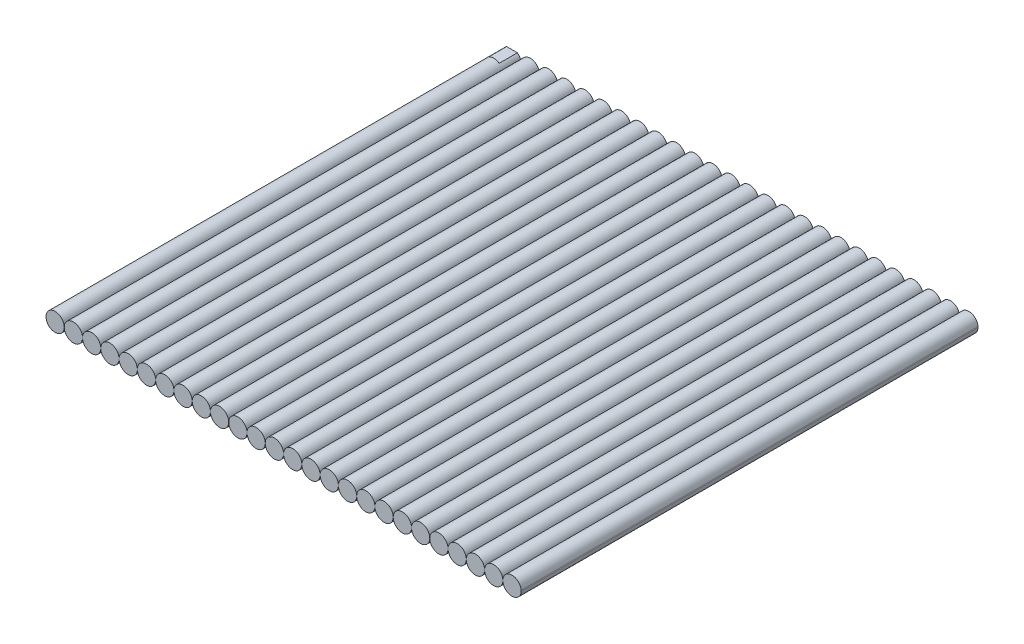
from build123d import *

# Parameters (mm, degrees)
BOSS_EXTRUDE1_DEPTH    = 25
BOSS_EXTRUDE1_2_DEPTH  = 25
BOSS_EXTRUDE1_3_DEPTH  = 25
BOSS_EXTRUDE1_4_DEPTH  = 25
BOSS_EXTRUDE1_5_DEPTH  = 25
BOSS_EXTRUDE1_6_DEPTH  = 25
BOSS_EXTRUDE1_7_DEPTH  = 25
BOSS_EXTRUDE1_8_DEPTH  = 25
BOSS_EXTRUDE1_9_DEPTH  = 25
BOSS_EXTRUDE1_10_DEPTH = 25
BOSS_EXTRUDE1_11_DEPTH = 25
BOSS_EXTRUDE1_12_DEPTH = 25
BOSS_EXTRUDE1_13_DEPTH = 25
BOSS_EXTRUDE1_14_DEPTH = 25
BOSS_EXTRUDE1_15_DEPTH = 25
BOSS_EXTRUDE1_16_DEPTH = 25
BOSS_EXTRUDE1_17_DEPTH = 25
BOSS_EXTRUDE1_18_DEPTH = 25
BOSS_EXTRUDE1_19_DEPTH = 25
BOSS_EXTRUDE1_20_DEPTH = 25
BOSS_EXTRUDE1_21_DEPTH = 25
BOSS_EXTRUDE1_22_DEPTH = 25
BOSS_EXTRUDE1_23_DEPTH = 25
BOSS_EXTRUDE1_24_DEPTH = 25
BOSS_EXTRUDE1_25_DEPTH = 25
BOSS_EXTRUDE1_26_DEPTH = 25
SKETCH2_W              = 0.795505405
SKETCH2_H              = 0.59017602
CUT_EXTRUDE1_DEPTH     = 1


with BuildPart() as part:
    # Sketch1 → Boss-Extrude1 (new body)
    with BuildSketch(Plane.XY):
        with BuildLine():
            ThreePointArc((25.001, 0.5), (25.485188612, 0.000250063), (26, 0.468393039))
            Line((26, 0.468393039), (26, 0.531606961))
            ThreePointArc((26, 0.531606961), (25.485188612, 0.999749937), (25.001, 0.5))
        make_face()
    extrude(amount=BOSS_EXTRUDE1_DEPTH)


with BuildPart() as body_2:
    # Sketch1 → Boss-Extrude1 2 (new body)
    with BuildSketch(Plane.XY):
        with BuildLine():
            ThreePointArc((1, 0.468393039), (1.000749937, 0.484188612), (1.001, 0.5))
            ThreePointArc((1.001, 0.5), (0.001250063, 0.515811388), (1, 0.468393039))
        make_face()
    extrude(amount=BOSS_EXTRUDE1_2_DEPTH)

    # Sketch2 → Cut-Extrude1 (cut)
    with BuildSketch(Plane(origin=(0, 0, 0), x_dir=(-1, 0, 0), z_dir=(0, 0, -1))):
        with Locations((-0.398752703, 1.198419828)):
            Rectangle(SKETCH2_W, SKETCH2_H)
    extrude(amount=-CUT_EXTRUDE1_DEPTH, mode=Mode.SUBTRACT)


with BuildPart() as body_3:
    # Sketch1 → Boss-Extrude1 3 (new body)
    with BuildSketch(Plane.XY):
        with BuildLine():
            ThreePointArc((2, 0.468393039), (2.000749937, 0.484188612), (2.001, 0.5))
            ThreePointArc((2.001, 0.5), (1.501, 1), (1.001, 0.5))
            ThreePointArc((1.001, 0.5), (1.485188612, 0.000250063), (2, 0.468393039))
        make_face()
    extrude(amount=BOSS_EXTRUDE1_3_DEPTH)


with BuildPart() as body_4:
    # Sketch1 → Boss-Extrude1 4 (new body)
    with BuildSketch(Plane.XY):
        with BuildLine():
            ThreePointArc((3, 0.468393039), (3.000749937, 0.484188612), (3.001, 0.5))
            ThreePointArc((3.001, 0.5), (2.501, 1), (2.001, 0.5))
            ThreePointArc((2.001, 0.5), (2.485188612, 0.000250063), (3, 0.468393039))
        make_face()
    extrude(amount=BOSS_EXTRUDE1_4_DEPTH)


with BuildPart() as body_5:
    # Sketch1 → Boss-Extrude1 5 (new body)
    with BuildSketch(Plane.XY):
        with BuildLine():
            ThreePointArc((4, 0.468393039), (4.000749937, 0.484188612), (4.001, 0.5))
            ThreePointArc((4.001, 0.5), (3.501, 1), (3.001, 0.5))
            ThreePointArc((3.001, 0.5), (3.485188612, 0.000250063), (4, 0.468393039))
        make_face()
    extrude(amount=BOSS_EXTRUDE1_5_DEPTH)


with BuildPart() as body_6:
    # Sketch1 → Boss-Extrude1 6 (new body)
    with BuildSketch(Plane.XY):
        with BuildLine():
            ThreePointArc((5, 0.468393039), (5.000749937, 0.484188612), (5.001, 0.5))
            ThreePointArc((5.001, 0.5), (4.501, 1), (4.001, 0.5))
            ThreePointArc((4.001, 0.5), (4.485188612, 0.000250063), (5, 0.468393039))
        make_face()
    extrude(amount=BOSS_EXTRUDE1_6_DEPTH)


with BuildPart() as body_7:
    # Sketch1 → Boss-Extrude1 7 (new body)
    with BuildSketch(Plane.XY):
        with BuildLine():
            ThreePointArc((6, 0.468393039), (6.000749937, 0.484188612), (6.001, 0.5))
            ThreePointArc((6.001, 0.5), (5.501, 1), (5.001, 0.5))
            ThreePointArc((5.001, 0.5), (5.485188612, 0.000250063), (6, 0.468393039))
        make_face()
    extrude(amount=BOSS_EXTRUDE1_7_DEPTH)


with BuildPart() as body_8:
    # Sketch1 → Boss-Extrude1 8 (new body)
    with BuildSketch(Plane.XY):
        with BuildLine():
            ThreePointArc((7, 0.468393039), (7.000749937, 0.484188612), (7.001, 0.5))
            ThreePointArc((7.001, 0.5), (6.501, 1), (6.001, 0.5))
            ThreePointArc((6.001, 0.5), (6.485188612, 0.000250063), (7, 0.468393039))
        make_face()
    extrude(amount=BOSS_EXTRUDE1_8_DEPTH)


with BuildPart() as body_9:
    # Sketch1 → Boss-Extrude1 9 (new body)
    with BuildSketch(Plane.XY):
        with BuildLine():
            ThreePointArc((8, 0.468393039), (8.000749937, 0.484188612), (8.001, 0.5))
            ThreePointArc((8.001, 0.5), (7.501, 1), (7.001, 0.5))
            ThreePointArc((7.001, 0.5), (7.485188612, 0.000250063), (8, 0.468393039))
        make_face()
    extrude(amount=BOSS_EXTRUDE1_9_DEPTH)


with BuildPart() as body_10:
    # Sketch1 → Boss-Extrude1 10 (new body)
    with BuildSketch(Plane.XY):
        with BuildLine():
            ThreePointArc((9, 0.468393039), (9.000749937, 0.484188612), (9.001, 0.5))
            ThreePointArc((9.001, 0.5), (8.501, 1), (8.001, 0.5))
            ThreePointArc((8.001, 0.5), (8.485188612, 0.000250063), (9, 0.468393039))
        make_face()
    extrude(amount=BOSS_EXTRUDE1_10_DEPTH)


with BuildPart() as body_11:
    # Sketch1 → Boss-Extrude1 11 (new body)
    with BuildSketch(Plane.XY):
        with BuildLine():
            ThreePointArc((10, 0.468393039), (10.000749937, 0.484188612), (10.001, 0.5))
            ThreePointArc((10.001, 0.5), (9.501, 1), (9.001, 0.5))
            ThreePointArc((9.001, 0.5), (9.485188612, 0.000250063), (10, 0.468393039))
        make_face()
    extrude(amount=BOSS_EXTRUDE1_11_DEPTH)


with BuildPart() as body_12:
    # Sketch1 → Boss-Extrude1 12 (new body)
    with BuildSketch(Plane.XY):
        with BuildLine():
            ThreePointArc((11, 0.468393039), (11.000749937, 0.484188612), (11.001, 0.5))
            ThreePointArc((11.001, 0.5), (10.501, 1), (10.001, 0.5))
            ThreePointArc((10.001, 0.5), (10.485188612, 0.000250063), (11, 0.468393039))
        make_face()
    extrude(amount=BOSS_EXTRUDE1_12_DEPTH)


with BuildPart() as body_13:
    # Sketch1 → Boss-Extrude1 13 (new body)
    with BuildSketch(Plane.XY):
        with BuildLine():
            ThreePointArc((12, 0.468393039), (12.000749937, 0.484188612), (12.001, 0.5))
            ThreePointArc((12.001, 0.5), (11.501, 1), (11.001, 0.5))
            ThreePointArc((11.001, 0.5), (11.485188612, 0.000250063), (12, 0.468393039))
        make_face()
    extrude(amount=BOSS_EXTRUDE1_13_DEPTH)


with BuildPart() as body_14:
    # Sketch1 → Boss-Extrude1 14 (new body)
    with BuildSketch(Plane.XY):
        with BuildLine():
            ThreePointArc((13, 0.468393039), (13.000749937, 0.484188612), (13.001, 0.5))
            ThreePointArc((13.001, 0.5), (12.501, 1), (12.001, 0.5))
            ThreePointArc((12.001, 0.5), (12.485188612, 0.000250063), (13, 0.468393039))
        make_face()
    extrude(amount=BOSS_EXTRUDE1_14_DEPTH)


with BuildPart() as body_15:
    # Sketch1 → Boss-Extrude1 15 (new body)
    with BuildSketch(Plane.XY):
        with BuildLine():
            ThreePointArc((14, 0.468393039), (14.000749937, 0.484188612), (14.001, 0.5))
            ThreePointArc((14.001, 0.5), (13.501, 1), (13.001, 0.5))
            ThreePointArc((13.001, 0.5), (13.485188612, 0.000250063), (14, 0.468393039))
        make_face()
    extrude(amount=BOSS_EXTRUDE1_15_DEPTH)


with BuildPart() as body_16:
    # Sketch1 → Boss-Extrude1 16 (new body)
    with BuildSketch(Plane.XY):
        with BuildLine():
            ThreePointArc((15, 0.468393039), (15.000749937, 0.484188612), (15.001, 0.5))
            ThreePointArc((15.001, 0.5), (14.501, 1), (14.001, 0.5))
            ThreePointArc((14.001, 0.5), (14.485188612, 0.000250063), (15, 0.468393039))
        make_face()
    extrude(amount=BOSS_EXTRUDE1_16_DEPTH)


with BuildPart() as body_17:
    # Sketch1 → Boss-Extrude1 17 (new body)
    with BuildSketch(Plane.XY):
        with BuildLine():
            ThreePointArc((16, 0.468393039), (16.000749937, 0.484188612), (16.001, 0.5))
            ThreePointArc((16.001, 0.5), (15.501, 1), (15.001, 0.5))
            ThreePointArc((15.001, 0.5), (15.485188612, 0.000250063), (16, 0.468393039))
        make_face()
    extrude(amount=BOSS_EXTRUDE1_17_DEPTH)


with BuildPart() as body_18:
    # Sketch1 → Boss-Extrude1 18 (new body)
    with BuildSketch(Plane.XY):
        with BuildLine():
            ThreePointArc((17, 0.468393039), (17.000749937, 0.484188612), (17.001, 0.5))
            ThreePointArc((17.001, 0.5), (16.501, 1), (16.001, 0.5))
            ThreePointArc((16.001, 0.5), (16.485188612, 0.000250063), (17, 0.468393039))
        make_face()
    extrude(amount=BOSS_EXTRUDE1_18_DEPTH)


with BuildPart() as body_19:
    # Sketch1 → Boss-Extrude1 19 (new body)
    with BuildSketch(Plane.XY):
        with BuildLine():
            ThreePointArc((18, 0.468393039), (18.000749937, 0.484188612), (18.001, 0.5))
            ThreePointArc((18.001, 0.5), (17.501, 1), (17.001, 0.5))
            ThreePointArc((17.001, 0.5), (17.485188612, 0.000250063), (18, 0.468393039))
        make_face()
    extrude(amount=BOSS_EXTRUDE1_19_DEPTH)


with BuildPart() as body_20:
    # Sketch1 → Boss-Extrude1 20 (new body)
    with BuildSketch(Plane.XY):
        with BuildLine():
            ThreePointArc((19, 0.468393039), (19.000749937, 0.484188612), (19.001, 0.5))
            ThreePointArc((19.001, 0.5), (18.501, 1), (18.001, 0.5))
            ThreePointArc((18.001, 0.5), (18.485188612, 0.000250063), (19, 0.468393039))
        make_face()
    extrude(amount=BOSS_EXTRUDE1_20_DEPTH)


with BuildPart() as body_21:
    # Sketch1 → Boss-Extrude1 21 (new body)
    with BuildSketch(Plane.XY):
        with BuildLine():
            ThreePointArc((20, 0.468393039), (20.000749937, 0.484188612), (20.001, 0.5))
            ThreePointArc((20.001, 0.5), (19.501, 1), (19.001, 0.5))
            ThreePointArc((19.001, 0.5), (19.485188612, 0.000250063), (20, 0.468393039))
        make_face()
    extrude(amount=BOSS_EXTRUDE1_21_DEPTH)


with BuildPart() as body_22:
    # Sketch1 → Boss-Extrude1 22 (new body)
    with BuildSketch(Plane.XY):
        with BuildLine():
            ThreePointArc((21, 0.468393039), (21.000749937, 0.484188612), (21.001, 0.5))
            ThreePointArc((21.001, 0.5), (20.501, 1), (20.001, 0.5))
            ThreePointArc((20.001, 0.5), (20.485188612, 0.000250063), (21, 0.468393039))
        make_face()
    extrude(amount=BOSS_EXTRUDE1_22_DEPTH)


with BuildPart() as body_23:
    # Sketch1 → Boss-Extrude1 23 (new body)
    with BuildSketch(Plane.XY):
        with BuildLine():
            ThreePointArc((22, 0.468393039), (22.000749937, 0.484188612), (22.001, 0.5))
            ThreePointArc((22.001, 0.5), (21.501, 1), (21.001, 0.5))
            ThreePointArc((21.001, 0.5), (21.485188612, 0.000250063), (22, 0.468393039))
        make_face()
    extrude(amount=BOSS_EXTRUDE1_23_DEPTH)


with BuildPart() as body_24:
    # Sketch1 → Boss-Extrude1 24 (new body)
    with BuildSketch(Plane.XY):
        with BuildLine():
            ThreePointArc((23, 0.468393039), (23.000749937, 0.484188612), (23.001, 0.5))
            ThreePointArc((23.001, 0.5), (22.501, 1), (22.001, 0.5))
            ThreePointArc((22.001, 0.5), (22.485188612, 0.000250063), (23, 0.468393039))
        make_face()
    extrude(amount=BOSS_EXTRUDE1_24_DEPTH)


with BuildPart() as body_25:
    # Sketch1 → Boss-Extrude1 25 (new body)
    with BuildSketch(Plane.XY):
        with BuildLine():
            ThreePointArc((24, 0.468393039), (24.000749937, 0.484188612), (24.001, 0.5))
            ThreePointArc((24.001, 0.5), (23.501, 1), (23.001, 0.5))
            ThreePointArc((23.001, 0.5), (23.485188612, 0.000250063), (24, 0.468393039))
        make_face()
    extrude(amount=BOSS_EXTRUDE1_25_DEPTH)


with BuildPart() as body_26:
    # Sketch1 → Boss-Extrude1 26 (new body)
    with BuildSketch(Plane.XY):
        with BuildLine():
            ThreePointArc((25, 0.468393039), (25.000749937, 0.484188612), (25.001, 0.5))
            ThreePointArc((25.001, 0.5), (24.501, 1), (24.001, 0.5))
            ThreePointArc((24.001, 0.5), (24.485188612, 0.000250063), (25, 0.468393039))
        make_face()
    extrude(amount=BOSS_EXTRUDE1_26_DEPTH)


solid = Compound([part.part, body_2.part, body_3.part, body_4.part, body_5.part, body_6.part, body_7.part, body_8.part, body_9.part, body_10.part, body_11.part, body_12.part, body_13.part, body_14.part, body_15.part, body_16.part, body_17.part, body_18.part, body_19.part, body_20.part, body_21.part, body_22.part, body_23.part, body_24.part, body_25.part, body_26.part])
